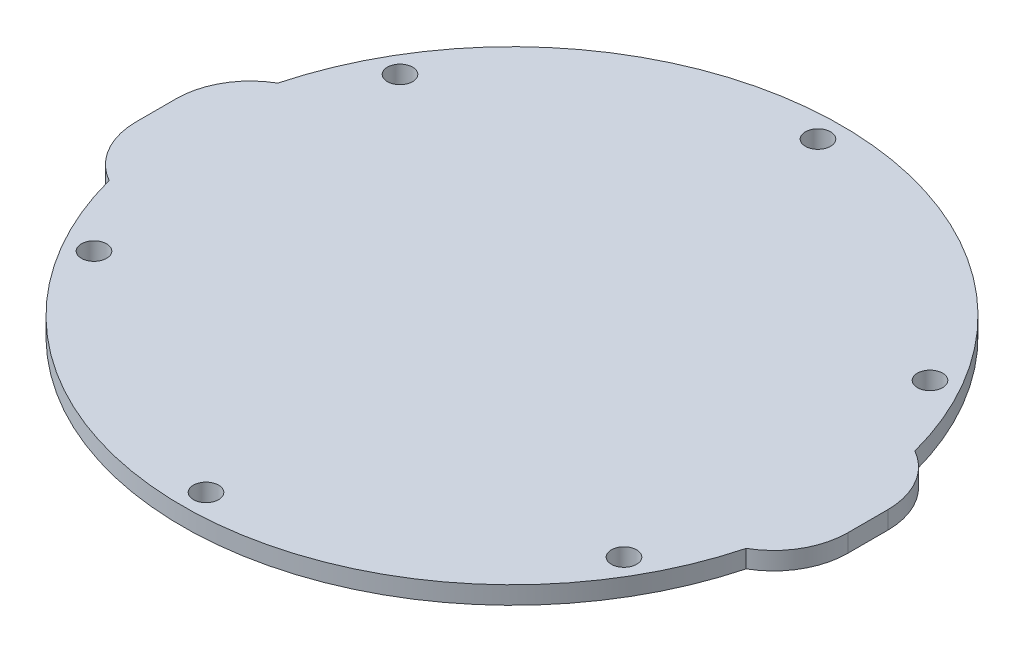
from build123d import *

# Parameters (mm, degrees)
BOSS_EXTRUDE1_DEPTH  = 2.4
M3_CLEARANCE_HOLE1_D = 3.4
CIRPATTERN1_COUNT    = 6


with BuildPart() as part:
    # Sketch1 → Boss-Extrude1 (new body)
    with BuildSketch(Plane(origin=(0, 0, 0), x_dir=(1, 0, 0), z_dir=(0, 1, 0))):
        with BuildLine():
            ThreePointArc((-42.969094344, -11.378024049), (-44.45, 0), (-42.969094344, 11.378024049))
            ThreePointArc((-42.969094344, 11.378024049), (-46.651327743, 7.715429023), (-48, 2.7))
            Line((-48, 2.7), (-48, -2.7))
            ThreePointArc((-48, -2.7), (-46.651327743, -7.715429023), (-42.969094344, -11.378024049))
        make_face()
        with BuildLine():
            Line((38, 12.7), (-38, 12.7))
            ThreePointArc((-38, 12.7), (-40.570968641, 12.363856386), (-42.969094344, 11.378024049))
            ThreePointArc((-42.969094344, 11.378024049), (-44.45, 0), (-42.969094344, -11.378024049))
            ThreePointArc((-42.969094344, -11.378024049), (-40.570968641, -12.363856386), (-38, -12.7))
            Line((-38, -12.7), (38, -12.7))
            ThreePointArc((38, -12.7), (40.570968641, -12.363856386), (42.969094344, -11.378024049))
            ThreePointArc((42.969094344, -11.378024049), (44.078218791, -5.736996445), (44.45, 0))
            ThreePointArc((44.45, 0), (44.078218791, 5.736996445), (42.969094344, 11.378024049))
            ThreePointArc((42.969094344, 11.378024049), (40.570968641, 12.363856386), (38, 12.7))
        make_face()
        with BuildLine():
            ThreePointArc((-38, -12.7), (-40.570968641, -12.363856386), (-42.969094344, -11.378024049))
            ThreePointArc((-42.969094344, -11.378024049), (0, -44.45), (42.969094344, -11.378024049))
            ThreePointArc((42.969094344, -11.378024049), (40.570968641, -12.363856386), (38, -12.7))
            Line((38, -12.7), (-38, -12.7))
        make_face()
        with BuildLine():
            ThreePointArc((-42.969094344, 11.378024049), (-40.570968641, 12.363856386), (-38, 12.7))
            Line((-38, 12.7), (38, 12.7))
            ThreePointArc((38, 12.7), (40.570968641, 12.363856386), (42.969094344, 11.378024049))
            ThreePointArc((42.969094344, 11.378024049), (0, 44.45), (-42.969094344, 11.378024049))
        make_face()
        with BuildLine():
            ThreePointArc((48, 2.7), (46.651327743, 7.715429023), (42.969094344, 11.378024049))
            ThreePointArc((42.969094344, 11.378024049), (44.078218791, 5.736996445), (44.45, 0))
            ThreePointArc((44.45, 0), (44.078218791, -5.736996445), (42.969094344, -11.378024049))
            ThreePointArc((42.969094344, -11.378024049), (46.651327743, -7.715429023), (48, -2.7))
            Line((48, -2.7), (48, 2.7))
        make_face()
    extrude(amount=BOSS_EXTRUDE1_DEPTH)

    # M3 Clearance Hole1 (through all)
    with Locations(Plane(origin=(0, 2.4, -41.275), x_dir=(0, 0, 1), z_dir=(0, 1, 0))):
        with Locations((0, 0)):
            m3_clearance_hole1 = Hole(M3_CLEARANCE_HOLE1_D / 2)

    # CirPattern1: M3 Clearance Hole1 ×6 about axis
    cirpattern1_axis = Axis((0, 0, 0), (0, 1, 0))
    for i in range(1, CIRPATTERN1_COUNT):
        add(m3_clearance_hole1.rotate(cirpattern1_axis, i * 360 / CIRPATTERN1_COUNT), mode=Mode.SUBTRACT)


solid = part.part
